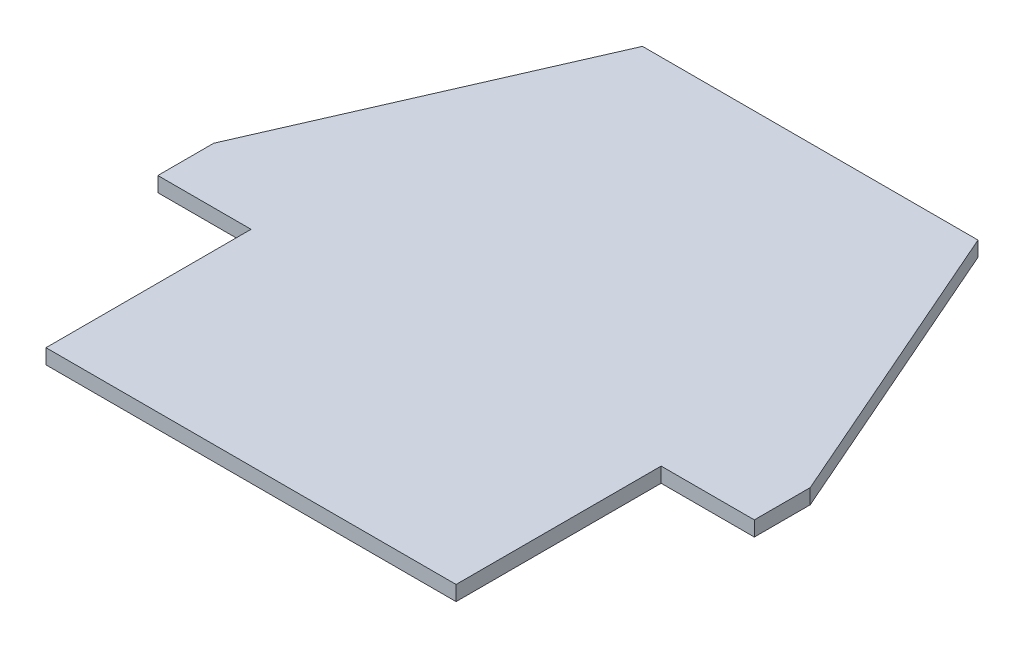
from build123d import *

# Parameters (mm, degrees)
SALIENTE_EXTRUIR1_DEPTH = 2


with BuildPart() as part:
    # Croquis1 → Saliente-Extruir1 (new, symmetric)
    with BuildSketch(Plane(origin=(0, 0, 0), x_dir=(1, 0, 0), z_dir=(0, 1, 0))):
        Polygon((-55, 0), (0, 0), (0, 150), (-45, 150), (-80, 70), (-80, 55), (-55, 55), align=None)
        Polygon((0, 150), (0, 0), (55, 0), (55, 55), (80, 55), (80, 70), (45, 150), align=None)
    extrude(amount=SALIENTE_EXTRUIR1_DEPTH, both=True)


solid = part.part
